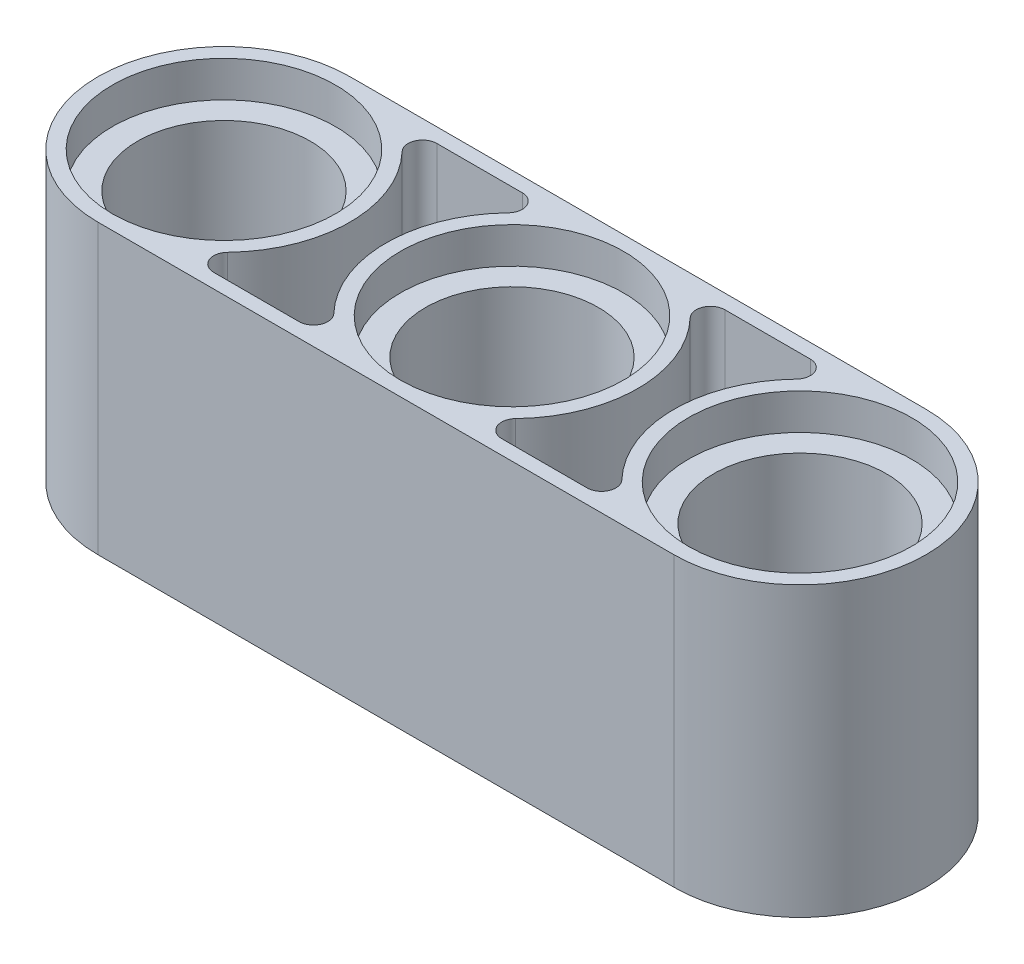
from build123d import *

# Parameters (mm, degrees)
BOSS_EXTRUDE1_DEPTH = 4
SKETCH3_R           = 3.1
CUT_EXTRUDE1_DEPTH  = 1
SKETCH4_R           = 2.4
CUT_EXTRUDE2_DEPTH  = 22.365860619
CUT_EXTRUDE4_START  = -1
SKETCH7_R           = 3.1
CUT_EXTRUDE4_DEPTH  = 1
LPATTERN3_COUNT     = 3
LPATTERN3_PITCH     = 8
CUT_EXTRUDE5_DEPTH  = 22.365860619
LPATTERN4_COUNT     = 2
LPATTERN4_PITCH     = 8


with BuildPart() as part:
    # Sketch2 → Boss-Extrude1 (new, symmetric)
    with BuildSketch(Plane(origin=(0, 0, 0), x_dir=(1, 0, 0), z_dir=(0, 1, 0))):
        with BuildLine():
            Line((0, 3.5), (16, 3.5))
            ThreePointArc((16, 3.5), (19.5, 0), (16, -3.5))
            Line((16, -3.5), (0, -3.5))
            ThreePointArc((0, -3.5), (-3.5, 0), (0, 3.5))
        make_face()
    extrude(amount=BOSS_EXTRUDE1_DEPTH, both=True)

    # Sketch3 → Cut-Extrude1 (cut)
    with BuildSketch(Plane(origin=(0, 4, 0), x_dir=(1, 0, 0), z_dir=(0, 1, 0))):
        with Locations(Location((0, 0, 0), (0, 0, 270))):
            Circle(SKETCH3_R)
    cut_extrude1 = extrude(amount=-CUT_EXTRUDE1_DEPTH, mode=Mode.SUBTRACT)

    # Sketch4 → Cut-Extrude2 (cut, through all)
    with BuildSketch(Plane(origin=(0, 4, 0), x_dir=(1, 0, 0), z_dir=(0, 1, 0))):
        with Locations(Location((0, 0, 0), (0, 0, 270))):
            Circle(SKETCH4_R)
    cut_extrude2 = extrude(amount=-CUT_EXTRUDE2_DEPTH, mode=Mode.SUBTRACT)

    # Sketch7 → Cut-Extrude4 (cut)
    with BuildSketch(Plane(origin=(0, -4, 0), x_dir=(-1, 0, 0), z_dir=(0, -1, 0)).offset(CUT_EXTRUDE4_START)):
        with Locations(Location((0, 0, 0), (0, 0, 270))):
            Circle(SKETCH7_R)
    cut_extrude4 = extrude(amount=CUT_EXTRUDE4_DEPTH, mode=Mode.SUBTRACT)

    # LPattern3: Cut-Extrude1, Cut-Extrude2, Cut-Extrude4 ×3
    with Locations(*[(i * LPATTERN3_PITCH, 0, 0) for i in range(1, LPATTERN3_COUNT)]):
        add(cut_extrude1, mode=Mode.SUBTRACT)
        add(cut_extrude2, mode=Mode.SUBTRACT)
        add(cut_extrude4, mode=Mode.SUBTRACT)

    # Sketch8 → Cut-Extrude5 (cut, through all)
    with BuildSketch(Plane(origin=(0, 4, 0), x_dir=(1, 0, 0), z_dir=(0, 1, 0))):
        with BuildLine():
            Line((2.814249456, 3.1), (5.185750544, 3.1))
            ThreePointArc((5.185750544, 3.1), (5.553697029, 2.856892908), (5.474391514, 2.423076923))
            ThreePointArc((5.474391514, 2.423076923), (4.5, 0), (5.474391514, -2.423076923))
            ThreePointArc((5.474391514, -2.423076923), (5.553697029, -2.856892908), (5.185750544, -3.1))
            Line((5.185750544, -3.1), (2.814249456, -3.1))
            ThreePointArc((2.814249456, -3.1), (2.446302971, -2.856892908), (2.525608486, -2.423076923))
            ThreePointArc((2.525608486, -2.423076923), (3.5, 0), (2.525608486, 2.423076923))
            ThreePointArc((2.525608486, 2.423076923), (2.446302971, 2.856892908), (2.814249456, 3.1))
        make_face()
    cut_extrude5 = extrude(amount=-CUT_EXTRUDE5_DEPTH, mode=Mode.SUBTRACT)

    # LPattern4: Cut-Extrude5 ×2
    with Locations(*[(i * LPATTERN4_PITCH, 0, 0) for i in range(1, LPATTERN4_COUNT)]):
        add(cut_extrude5, mode=Mode.SUBTRACT)


solid = part.part
